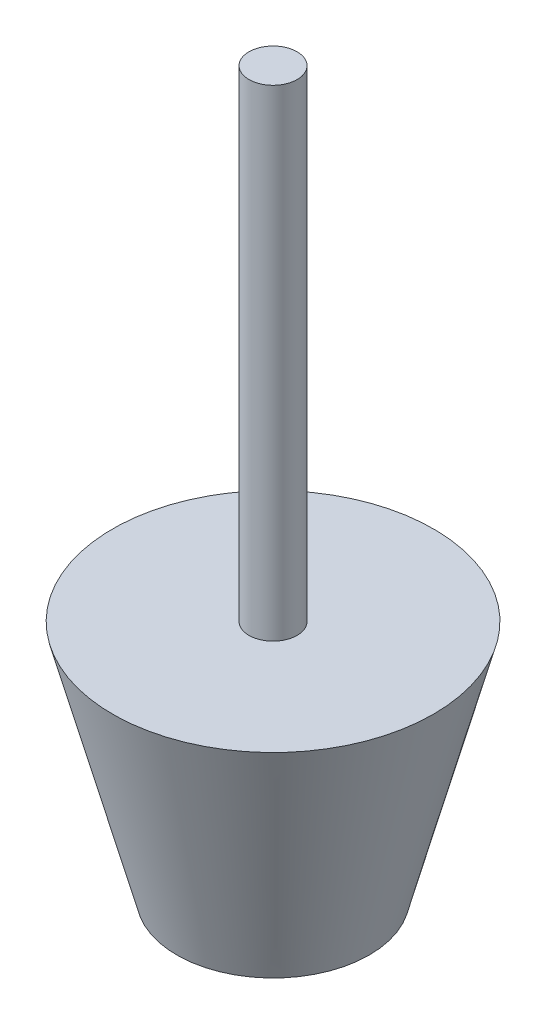
from build123d import *


with BuildPart() as part:
    # 草圖1 → 旋轉1 (revolve)
    with BuildSketch(Plane.XY, mode=Mode.PRIVATE) as revolve_1_sk:
        Polygon((-1.5, -15), (-10, -15), (-6, -30), (0, -30), (0, -15), (0, 15), (-1.5, 15), align=None)
    revolve(revolve_1_sk.sketch.rotate(Axis((0, -30, 0), (0, 1, 0)), 180), axis=Axis((0, -30, 0), (0, 1, 0)))


solid = part.part
